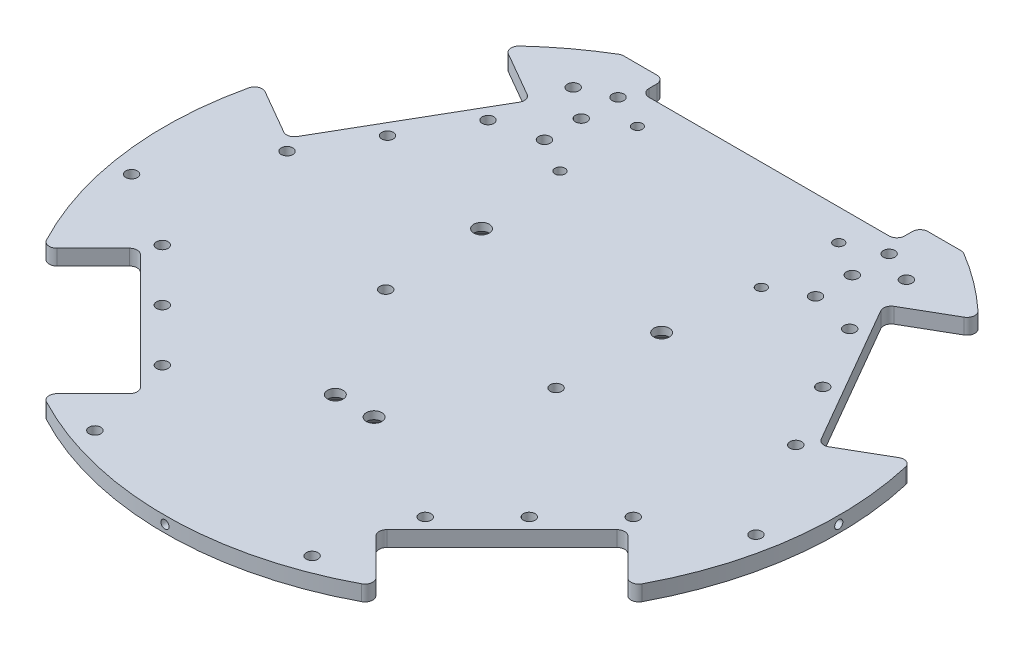
from build123d import *

# Parameters (mm, degrees)
BOSS_EXTRUDE1_DEPTH           = 2
FILLET1_R                     = 2
CSK_FOR_M3_SFHCS1_D           = 3
CSK_FOR_M3_SFHCS1_DEPTH       = 9.5
CSK_FOR_M3_SFHCS1_CSINK_D     = 5.6
CSK_FOR_M3_SFHCS1_CSINK_ANGLE = 90
CSK_FOR_M3_SFHCS1_TIP         = 0.901290929
CSK_FOR_M3_SFHCS2_D           = 3
CSK_FOR_M3_SFHCS2_DEPTH       = 9.5
CSK_FOR_M3_SFHCS2_CSINK_D     = 5.6
CSK_FOR_M3_SFHCS2_CSINK_ANGLE = 90
CSK_FOR_M3_SFHCS2_TIP         = 0.901290929
CSK_FOR_M3_SFHCS3_D           = 2.6
CSK_FOR_M3_SFHCS3_DEPTH       = 9.5
CSK_FOR_M3_SFHCS3_CSINK_D     = 4.6
CSK_FOR_M3_SFHCS3_CSINK_ANGLE = 90
CSK_FOR_M3_SFHCS3_TIP         = 0.781118805
CSK_FOR_M4_SFHCS3_D           = 4
CSK_FOR_M4_SFHCS3_DEPTH       = 9.5
CSK_FOR_M4_SFHCS3_CSINK_D     = 8
CSK_FOR_M4_SFHCS3_CSINK_ANGLE = 90
CSK_FOR_M4_SFHCS3_TIP         = 1.201721238
CSK_FOR_M3_SFHCS4_D           = 3
CSK_FOR_M3_SFHCS4_DEPTH       = 9.5
CSK_FOR_M3_SFHCS4_CSINK_D     = 5.6
CSK_FOR_M3_SFHCS4_CSINK_ANGLE = 90
CSK_FOR_M3_SFHCS4_TIP         = 0.901290929
SKETCH9_R                     = 1.05
CUT_EXTRUDE1_DEPTH            = 8
SKETCH10_R                    = 1.05
CUT_EXTRUDE2_DEPTH            = 8
SKETCH11_R                    = 1.05
CUT_EXTRUDE3_DEPTH            = 8
M2_5X0_45_TAPPED_HOLE1_D      = 2.05
M2_5X0_45_TAPPED_HOLE1_DEPTH  = 6.35
M2_5X0_45_TAPPED_HOLE1_TIP    = 0.615882135


with BuildPart() as part:
    # Sketch1 → Boss-Extrude1 (new, symmetric)
    with BuildSketch(Plane(origin=(0, 0, 0), x_dir=(1, 0, 0), z_dir=(0, 1, 0))):
        with BuildLine():
            Line((45.65767665, 52.918584287), (68.65767665, 13.081415713))
            Line((68.65767665, 13.081415713), (84.163608498, 22.03376964))
            ThreePointArc((84.163608498, 22.03376964), (86.25570294, -11.355778723), (75.593043864, -43.066131929))
            Line((75.593043864, -43.066131929), (62.932503526, -30.405591591))
            Line((62.932503526, -30.405591591), (30.405591591, -62.932503526))
            Line((30.405591591, -62.932503526), (43.066131929, -75.593043864))
            ThreePointArc((43.066131929, -75.593043864), (0, -87), (-43.066131929, -75.593043864))
            Line((-43.066131929, -75.593043864), (-30.405591591, -62.932503526))
            Line((-30.405591591, -62.932503526), (-62.932503526, -30.405591591))
            Line((-62.932503526, -30.405591591), (-75.593043864, -43.066131929))
            ThreePointArc((-75.593043864, -43.066131929), (-86.25570294, -11.355778723), (-84.163608498, 22.03376964))
            Line((-84.163608498, 22.03376964), (-68.65767665, 13.081415713))
            Line((-68.65767665, 13.081415713), (-45.65767665, 52.918584287))
            Line((-45.65767665, 52.918584287), (-61.163608498, 61.870938214))
            ThreePointArc((-61.163608498, 61.870938214), (-53.035049748, 68.965813982), (-44.09081537, 75))
            Line((-44.09081537, 75), (-33, 75))
            Line((-33, 75), (-33, 69))
            Line((-33, 69), (33, 69))
            Line((33, 69), (33, 75))
            Line((33, 75), (44.09081537, 75))
            ThreePointArc((44.09081537, 75), (53.035049748, 68.965813982), (61.163608498, 61.870938214))
            Line((61.163608498, 61.870938214), (45.65767665, 52.918584287))
        make_face()
    extrude(amount=BOSS_EXTRUDE1_DEPTH, both=True)

    # Fillet1
    fillet1_edges = [part.edges().sort_by_distance(p)[0] for p in [
        (33, 0, -75),
        (-33, 0, -75),
        (44.09081537, 0, -75),
        (68.65767665, 0, -13.081415713),
        (84.163608498, 0, -22.03376964),
        (45.65767665, 0, -52.918584287),
        (61.163608498, 0, -61.870938214),
        (62.932503526, 0, 30.405591591),
        (43.066131929, 0, 75.593043864),
        (30.405591591, 0, 62.932503526),
        (75.593043864, 0, 43.066131929),
        (-43.066131929, 0, 75.593043864),
        (-30.405591591, 0, 62.932503526),
        (-75.593043864, 0, 43.066131929),
        (-62.932503526, 0, 30.405591591),
        (-68.65767665, 0, -13.081415713),
        (-84.163608498, 0, -22.03376964),
        (-45.65767665, 0, -52.918584287),
        (33, 0, -69),
        (-33, 0, -69),
        (-44.09081537, 0, -75),
        (-61.163608498, 0, -61.870938214),
    ]]
    fillet(fillet1_edges, radius=FILLET1_R)

    # CSK for M3 SFHCS1
    with Locations(Plane(origin=(46.693575035, -2, -43.124355653), x_dir=(0, 0, -1), z_dir=(0, -1, 0))):
        with Locations((0, 0), (-16.454482672, 9.5), (-32.908965344, 19), (-69.994413338, 14.117608147), (-83.429442181, 0.682579304), (-96.864471023, -12.752449538), (-96.864471023, -80.634700532), (-83.429442181, -94.069729374), (-69.994413338, -107.504758217), (0, -93.38715007), (-16.454482672, -102.88715007), (-32.908965344, -112.38715007), (21.875644347, -81.693575035), (12.375644347, -81.693575035), (2.875644347, -81.693575035), (2.875644347, -11.693575035), (12.375644347, -11.693575035), (21.875644347, -11.693575035)):
            CounterSinkHole(CSK_FOR_M3_SFHCS1_D / 2, CSK_FOR_M3_SFHCS1_CSINK_D / 2, depth=CSK_FOR_M3_SFHCS1_DEPTH, counter_sink_angle=CSK_FOR_M3_SFHCS1_CSINK_ANGLE)
            with Locations((0, 0, -(CSK_FOR_M3_SFHCS1_DEPTH + CSK_FOR_M3_SFHCS1_TIP / 2))):  # 118° drill point
                Cone(0, CSK_FOR_M3_SFHCS1_D / 2, CSK_FOR_M3_SFHCS1_TIP, mode=Mode.SUBTRACT)

    # CSK for M3 SFHCS2
    with Locations(Plane(origin=(43.018232726, -2, -61.436403322), x_dir=(0, 0, -1), z_dir=(0, -1, 0))):
        with Locations((0, 0), (-76.436403322, 37.598142782), (-138.491198226, -14.972580973), (-138.491198226, -71.063884479), (-76.436403322, -123.634608234), (0, -86.036465452)):
            CounterSinkHole(CSK_FOR_M3_SFHCS2_D / 2, CSK_FOR_M3_SFHCS2_CSINK_D / 2, depth=CSK_FOR_M3_SFHCS2_DEPTH, counter_sink_angle=CSK_FOR_M3_SFHCS2_CSINK_ANGLE)
            with Locations((0, 0, -(CSK_FOR_M3_SFHCS2_DEPTH + CSK_FOR_M3_SFHCS2_TIP / 2))):  # 118° drill point
                Cone(0, CSK_FOR_M3_SFHCS2_D / 2, CSK_FOR_M3_SFHCS2_TIP, mode=Mode.SUBTRACT)

    # CSK for M3 SFHCS3
    with Locations(Plane(origin=(26, -2, -41), x_dir=(0, 0, -1), z_dir=(0, -1, 0))):
        with Locations((0, 0), (20, 0), (0, -52), (20, -52)):
            CounterSinkHole(CSK_FOR_M3_SFHCS3_D / 2, CSK_FOR_M3_SFHCS3_CSINK_D / 2, depth=CSK_FOR_M3_SFHCS3_DEPTH, counter_sink_angle=CSK_FOR_M3_SFHCS3_CSINK_ANGLE)
            with Locations((0, 0, -(CSK_FOR_M3_SFHCS3_DEPTH + CSK_FOR_M3_SFHCS3_TIP / 2))):  # 118° drill point
                Cone(0, CSK_FOR_M3_SFHCS3_D / 2, CSK_FOR_M3_SFHCS3_TIP, mode=Mode.SUBTRACT)

    # CSK for M4 SFHCS3
    with Locations(Plane(origin=(23.25, -2, -18), x_dir=(0, 0, -1), z_dir=(0, -1, 0))):
        with Locations((0, 0), (0, -46.5), (-56, -28.25), (-56, -18.25)):
            CounterSinkHole(CSK_FOR_M4_SFHCS3_D / 2, CSK_FOR_M4_SFHCS3_CSINK_D / 2, depth=CSK_FOR_M4_SFHCS3_DEPTH, counter_sink_angle=CSK_FOR_M4_SFHCS3_CSINK_ANGLE)
            with Locations((0, 0, -(CSK_FOR_M4_SFHCS3_DEPTH + CSK_FOR_M4_SFHCS3_TIP / 2))):  # 118° drill point
                Cone(0, CSK_FOR_M4_SFHCS3_D / 2, CSK_FOR_M4_SFHCS3_TIP, mode=Mode.SUBTRACT)

    # CSK for M3 SFHCS4
    with Locations(Plane(origin=(22, -2, 8), x_dir=(0, 0, -1), z_dir=(0, -1, 0))):
        with Locations((0, 0), (0, -44)):
            CounterSinkHole(CSK_FOR_M3_SFHCS4_D / 2, CSK_FOR_M3_SFHCS4_CSINK_D / 2, depth=CSK_FOR_M3_SFHCS4_DEPTH, counter_sink_angle=CSK_FOR_M3_SFHCS4_CSINK_ANGLE)
            with Locations((0, 0, -(CSK_FOR_M3_SFHCS4_DEPTH + CSK_FOR_M3_SFHCS4_TIP / 2))):  # 118° drill point
                Cone(0, CSK_FOR_M3_SFHCS4_D / 2, CSK_FOR_M3_SFHCS4_TIP, mode=Mode.SUBTRACT)

    # Sketch9 → Cut-Extrude1 (cut)
    with BuildSketch(Plane(origin=(87, 0, 0), x_dir=(0, 0, -1), z_dir=(1, 0, 0))):
        Circle(SKETCH9_R)
    cut_extrude1 = extrude(amount=-CUT_EXTRUDE1_DEPTH, mode=Mode.SUBTRACT)

    # Sketch10 → Cut-Extrude2 (cut)
    with BuildSketch(Plane.XY.offset(87)):
        Circle(SKETCH10_R)
    cut_extrude2 = extrude(amount=-CUT_EXTRUDE2_DEPTH, mode=Mode.SUBTRACT)

    # Sketch11 → Cut-Extrude3 (cut)
    with BuildSketch(Plane(origin=(52.182278256, 0, -69.613287783), x_dir=(-0.8001527331423806, 0, -0.5997963017931826), z_dir=(0.5997963017931826, 0, -0.8001527331423806))):
        Circle(SKETCH11_R)
    cut_extrude3 = extrude(amount=-CUT_EXTRUDE3_DEPTH, mode=Mode.SUBTRACT)

    # Mirror1: Cut-Extrude1, Cut-Extrude2, Cut-Extrude3 across plane
    add(cut_extrude1.mirror(Plane(origin=(0, 0, 0), x_dir=(0, 0, 1), z_dir=(1, 0, 0))), mode=Mode.SUBTRACT)
    add(cut_extrude2.mirror(Plane(origin=(0, 0, 0), x_dir=(0, 0, 1), z_dir=(1, 0, 0))), mode=Mode.SUBTRACT)
    add(cut_extrude3.mirror(Plane(origin=(0, 0, 0), x_dir=(0, 0, 1), z_dir=(1, 0, 0))), mode=Mode.SUBTRACT)

    # M2.5x0.45 Tapped Hole1
    with Locations(Plane(origin=(-39.271541057, 0, -75), x_dir=(-1, 0, 0), z_dir=(0, 0, -1))):
        with Locations((0, 0), (-78.717182785, 0)):
            Hole(M2_5X0_45_TAPPED_HOLE1_D / 2, depth=M2_5X0_45_TAPPED_HOLE1_DEPTH)
            with Locations((0, 0, -(M2_5X0_45_TAPPED_HOLE1_DEPTH + M2_5X0_45_TAPPED_HOLE1_TIP / 2))):  # 118° drill point
                Cone(0, M2_5X0_45_TAPPED_HOLE1_D / 2, M2_5X0_45_TAPPED_HOLE1_TIP, mode=Mode.SUBTRACT)


solid = part.part
